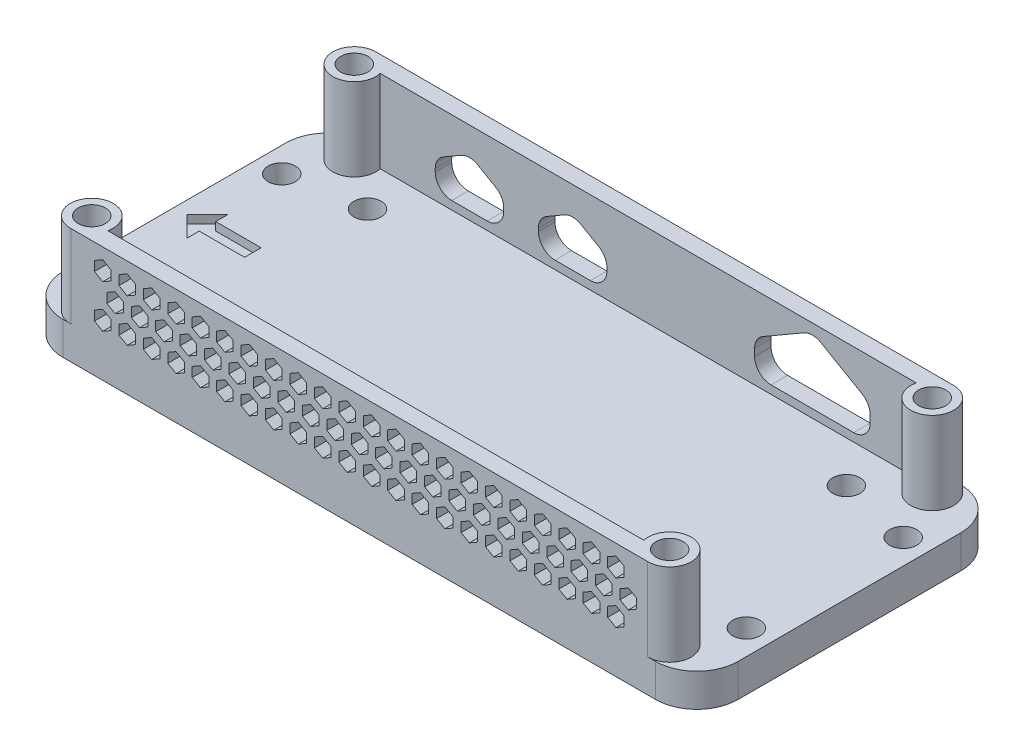
from build123d import *

# Parameters (mm, degrees)
SZKIC1_W                    = 81.77
SZKIC1_H                    = 37
SZKIC1_R                    = 1.65
DODANIE_WYCI_GNI_CIE1_DEPTH = 4
ZAOKR_GLENIE1_R             = 5
SZKIC2_R                    = 1.65
WYTNIJ_WYCI_GNI_CIE11_DEPTH = 3.5
SZKIC6_W                    = 69.77
SZKIC6_H                    = 2
DODANIE_WYCI_GNI_CIE2_DEPTH = 10
SZKIC7_W                    = 8.3
SZKIC7_H                    = 9
WYTNIJ_WYCI_GNI_CIE1_DEPTH  = 2
DODANIE_WYCI_GNI_CIE3_DEPTH = 2
ZAOKR_GLENIE2_R             = 2
WYTNIJ_WYCI_GNI_CIE6_REACH  = 58.891
SZKIC11_R                   = 2.6
DODANIE_WYCI_GNI_CIE4_DEPTH = 10
SZKIC14_R                   = 1.65
WYTNIJ_WYCI_GNI_CIE5_DEPTH  = 4.2
LUSTRO7_COPY_1_SKETCH_R     = 2.6
LUSTRO7_COPY_1_DEPTH        = 10
LUSTRO7_COPY_2_SKETCH_R     = 1.65
LUSTRO7_COPY_2_DEPTH        = 4.2
WYTNIJ_WYCI_GNI_CIE4_DEPTH  = 1
ZAOKR_GLENIE3_R             = 2
WYTNIJ_WYCI_GNI_CIE9_DEPTH  = 2
SZYK_LINIOWY1_COUNT         = 22
SZYK_LINIOWY1_PITCH         = 2.96


with BuildPart() as part:
    # Szkic1 → Dodanie-wyciągnięcie1 (new body)
    with BuildSketch(Plane(origin=(0, 0, 0), x_dir=(1, 0, 0), z_dir=(0, 1, 0))):
        Rectangle(SZKIC1_W, SZKIC1_H)
        with Locations(Location((-37.885, 10, 0), (0, 0, 270))):
            Circle(SZKIC1_R, mode=Mode.SUBTRACT)
        with Locations(Location((-37.885, -10, 0), (0, 0, 90))):
            Circle(SZKIC1_R, mode=Mode.SUBTRACT)
        with Locations(Location((37.885, 9.5, 0), (0, 0, 270))):
            Circle(SZKIC1_R, mode=Mode.SUBTRACT)
        with Locations(Location((37.885, -9.5, 0), (0, 0, 90))):
            Circle(SZKIC1_R, mode=Mode.SUBTRACT)
    extrude(amount=DODANIE_WYCI_GNI_CIE1_DEPTH)

    # Zaokrąglenie1
    zaokr_glenie1_edges = [part.edges().sort_by_distance(p)[0] for p in [
        (40.885, 2, 18.5),
        (-40.885, 2, 18.5),
        (-40.885, 2, -18.5),
        (40.885, 2, -18.5),
    ]]
    fillet(zaokr_glenie1_edges, radius=ZAOKR_GLENIE1_R)

    # Szkic2 → Wytnij-wyciągnięcie11 (cut)
    with BuildSketch(Plane(origin=(0, 4, 0), x_dir=(1, 0, 0), z_dir=(0, 1, 0))):
        with Locations(Location((29, 11.5, 0), (0, 0, 270))):
            Circle(SZKIC2_R)
        with Locations(Location((29, -11.5, 0), (0, 0, 270))):
            Circle(SZKIC2_R)
        with Locations(Location((-29, -11.5, 0), (0, 0, 270))):
            Circle(SZKIC2_R)
        with Locations(Location((-29, 11.5, 0), (0, 0, 270))):
            Circle(SZKIC2_R)
    extrude(amount=-WYTNIJ_WYCI_GNI_CIE11_DEPTH, mode=Mode.SUBTRACT)

    # Szkic6 → Dodanie-wyciągnięcie2 (add)
    with BuildSketch(Plane(origin=(0, 4, 0), x_dir=(1, 0, 0), z_dir=(0, 1, 0))):
        with Locations((0, -17.5)):
            Rectangle(SZKIC6_W, SZKIC6_H)
    dodanie_wyci_gni_cie2 = extrude(amount=DODANIE_WYCI_GNI_CIE2_DEPTH)

    # Lustro4: Dodanie-wyciągnięcie2 across plane
    add(dodanie_wyci_gni_cie2.mirror(Plane.XY))

    # Szkic7 → Wytnij-wyciągnięcie1 (cut)
    with BuildSketch(Plane(origin=(0, 0, -18.5), x_dir=(-1, 0, 0), z_dir=(0, 0, -1))):
        with Locations((9.15, 9.5)):
            Rectangle(SZKIC7_W, SZKIC7_H)
        with Locations((21.65, 9.5)):
            Rectangle(SZKIC7_W, SZKIC7_H)
    extrude(amount=-WYTNIJ_WYCI_GNI_CIE1_DEPTH, mode=Mode.SUBTRACT)

    # Szkic8 → Dodanie-wyciągnięcie3 (add)
    with BuildSketch(Plane(origin=(0, 0, -18.5), x_dir=(-1, 0, 0), z_dir=(0, 0, -1))):
        Polygon((5, 14), (5, 8.5), (9.15, 10.896003617), (13.3, 8.5), (13.3, 14), align=None)
        Polygon((17.5, 14), (25.8, 14), (25.8, 8.5), (21.65, 10.896003617), (17.5, 8.5), align=None)
    extrude(amount=-DODANIE_WYCI_GNI_CIE3_DEPTH)

    # Zaokrąglenie2
    zaokr_glenie2_edges = [part.edges().sort_by_distance(p)[0] for p in [
        (-17.5, 5, -17.5),
        (-25.8, 5, -17.5),
        (-5, 5, -17.5),
        (-13.3, 5, -17.5),
        (-5, 8.5, -17.5),
        (-9.15, 10.896003617, -17.5),
        (-13.3, 8.5, -17.5),
        (-17.5, 8.5, -17.5),
        (-21.65, 10.896003617, -17.5),
        (-25.8, 8.5, -17.5),
    ]]
    fillet(zaokr_glenie2_edges, radius=ZAOKR_GLENIE2_R)

    # Szkic15 → Wytnij-wyciągnięcie6 (cut, up to next)
    with BuildSketch(Plane(origin=(0, 0, -18.5), x_dir=(-1, 0, 0), z_dir=(0, 0, -1)), mode=Mode.PRIVATE) as wytnij_wyci_gni_cie6_sk1:
        Polygon((-19.885, 13.041451884), (-12.885, 9), (-12.885, 5), (-26.885, 5), (-26.885, 9), align=None)
    wytnij_wyci_gni_cie6_tool1 = extrude(wytnij_wyci_gni_cie6_sk1.sketch, amount=-WYTNIJ_WYCI_GNI_CIE6_REACH, mode=Mode.PRIVATE) & part.part
    add(wytnij_wyci_gni_cie6_tool1.solids().sort_by_distance((19.885, 8.123398, -18.5))[0], mode=Mode.SUBTRACT)

    # Szkic11 → Dodanie-wyciągnięcie4 (add)
    with BuildSketch(Plane(origin=(0, 4, 0), x_dir=(1, 0, 0), z_dir=(0, 1, 0))):
        with Locations((-35, -15.9)):
            Circle(SZKIC11_R)
    dodanie_wyci_gni_cie4 = extrude(amount=DODANIE_WYCI_GNI_CIE4_DEPTH)

    # Szkic14 → Wytnij-wyciągnięcie5 (cut)
    with BuildSketch(Plane(origin=(0, 14, 0), x_dir=(1, 0, 0), z_dir=(0, 1, 0))):
        with Locations(Location((-35, -15.9, 0), (0, 0, 270))):
            Circle(SZKIC14_R)
    wytnij_wyci_gni_cie5 = extrude(amount=-WYTNIJ_WYCI_GNI_CIE5_DEPTH, mode=Mode.SUBTRACT)

    # Lustro6: Dodanie-wyciągnięcie4, Wytnij-wyciągnięcie5 across plane
    add(dodanie_wyci_gni_cie4.mirror(Plane.XY))
    add(wytnij_wyci_gni_cie5.mirror(Plane.XY), mode=Mode.SUBTRACT)

    # Lustro7: Dodanie-wyciągnięcie4, Wytnij-wyciągnięcie5 across plane
    add(dodanie_wyci_gni_cie4.mirror(Plane(origin=(0, 0, 0), x_dir=(0, 0, 1), z_dir=(1, 0, 0))))
    add(wytnij_wyci_gni_cie5.mirror(Plane(origin=(0, 0, 0), x_dir=(0, 0, 1), z_dir=(1, 0, 0))), mode=Mode.SUBTRACT)

    # Lustro7 copy 1 sketch → Lustro7 copy 1 (add)
    with BuildSketch(Plane(origin=(0, 4, 0), x_dir=(-1, 0, 0), z_dir=(0, 1, 0))):
        with Locations((-35, -15.9)):
            Circle(LUSTRO7_COPY_1_SKETCH_R)
    extrude(amount=LUSTRO7_COPY_1_DEPTH)

    # Lustro7 copy 2 sketch → Lustro7 copy 2 (cut)
    with BuildSketch(Plane(origin=(0, 14, 0), x_dir=(-1, 0, 0), z_dir=(0, 1, 0))):
        with Locations(Location((-35, -15.9, 0), (0, 0, 270))):
            Circle(LUSTRO7_COPY_2_SKETCH_R)
    extrude(amount=-LUSTRO7_COPY_2_DEPTH, mode=Mode.SUBTRACT)

    # Szkic13 → Wytnij-wyciągnięcie4 (cut)
    with BuildSketch(Plane(origin=(0, 4, 0), x_dir=(1, 0, 0), z_dir=(0, 1, 0))):
        Polygon((-39.385, 0), (-36.885, 2.5), (-36.885, 1), (-31.385, 1), (-31.385, -1), (-36.885, -1), (-36.885, -2.5), align=None)
    extrude(amount=-WYTNIJ_WYCI_GNI_CIE4_DEPTH, mode=Mode.SUBTRACT)

    # Zaokrąglenie3
    zaokr_glenie3_edges = [part.edges().sort_by_distance(p)[0] for p in [
        (26.885, 9, -17.5),
        (26.885, 5, -17.5),
        (12.885, 5, -17.5),
        (12.885, 9, -17.5),
        (19.885, 13.041451884, -17.5),
    ]]
    fillet(zaokr_glenie3_edges, radius=ZAOKR_GLENIE3_R)

    # Szkic18 → Wytnij-wyciągnięcie9 (cut)
    with BuildSketch(Plane.XY.offset(18.5)):
        Polygon((-31.070177872, 10.345299462), (-30.070177872, 10.922649731), (-30.070177872, 12.077350269), (-31.070177872, 12.654700538), (-32.070177872, 12.077350269), (-32.070177872, 10.922649731), align=None)
        Polygon((-29.570177872, 10.056624327), (-30.570177872, 9.479274058), (-30.570177872, 8.324573519), (-29.570177872, 7.74722325), (-28.570177872, 8.324573519), (-28.570177872, 9.479274058), align=None)
        Polygon((-31.070177872, 5.149147039), (-30.070177872, 5.726497308), (-30.070177872, 6.881197846), (-31.070177872, 7.458548116), (-32.070177872, 6.881197846), (-32.070177872, 5.726497308), align=None)
    wytnij_wyci_gni_cie9 = extrude(amount=-WYTNIJ_WYCI_GNI_CIE9_DEPTH, mode=Mode.SUBTRACT)

    # Szyk liniowy1: Wytnij-wyciągnięcie9 ×22
    with Locations(*[(i * SZYK_LINIOWY1_PITCH, 0, 0) for i in range(1, SZYK_LINIOWY1_COUNT)]):
        add(wytnij_wyci_gni_cie9, mode=Mode.SUBTRACT)


solid = part.part
